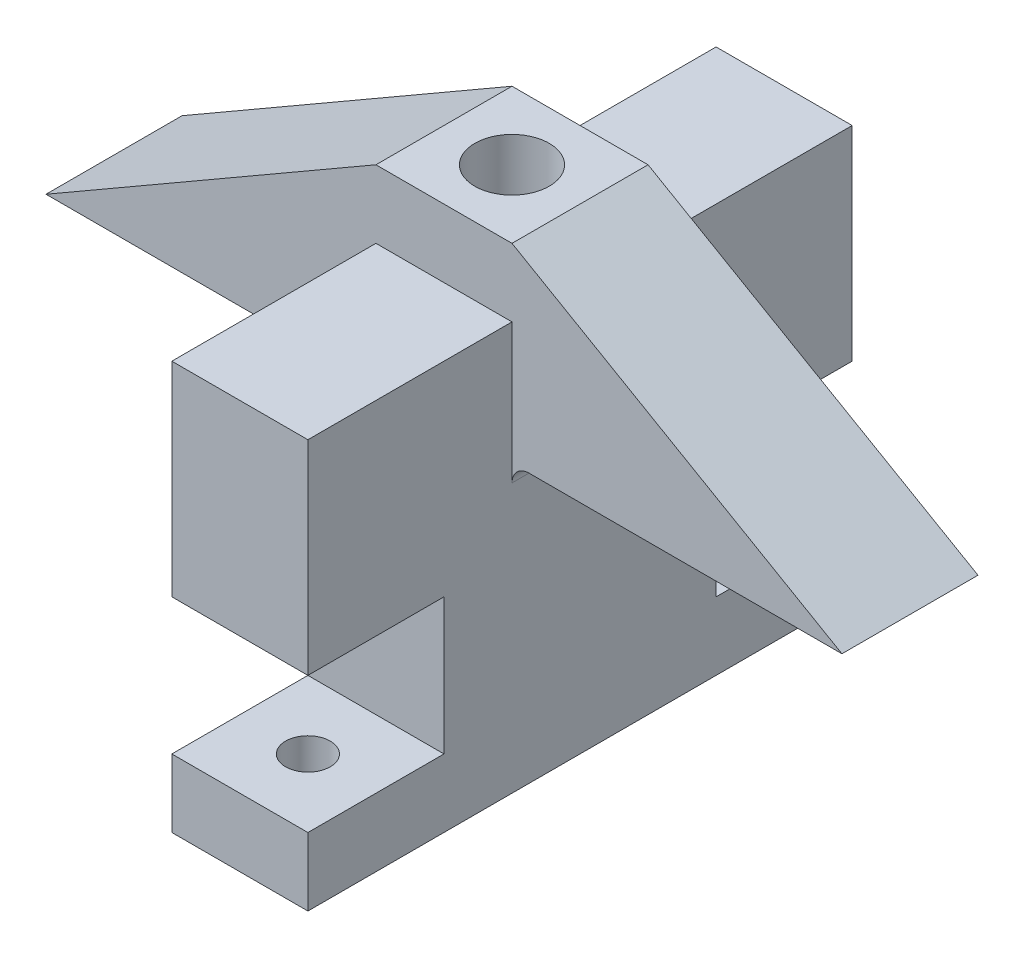
from build123d import *

# Parameters (mm, degrees)
BOSS_EXTRUDE1_DEPTH        = 25.4
SKETCH2_W                  = 25.4
SKETCH2_H                  = 12.7
BOSS_EXTRUDE2_DEPTH        = 38.1
SKETCH3_W                  = 25.4
SKETCH3_H                  = 12.7
BOSS_EXTRUDE3_DEPTH        = 38.1
F_0_328IN_DOWEL_HOLE1_D    = 8.3312
F_0_55IN_DOWEL_HOLE2_D     = 13.8938
F_0_55IN_DOWEL_HOLE2_DEPTH = 35.052
F_0_55IN_DOWEL_HOLE2_TIP   = 4.174118634
FILLET1_R                  = 3.175
SKETCH8_W                  = 25.4
SKETCH8_H                  = 25.4
BOSS_EXTRUDE4_DEPTH        = 12.7
BOSS_EXTRUDE5_DEPTH        = 38.1
SKETCH9_W                  = 25.4
SKETCH9_H                  = 25.4
BOSS_EXTRUDE6_DEPTH        = 12.7
BOSS_EXTRUDE7_DEPTH        = 38.1


with BuildPart() as part:
    # Sketch1 → Boss-Extrude1 (new body)
    with BuildSketch(Plane.XY):
        Polygon((0, 0), (0, 53.34), (-61.591726717, 53.34), (0, 88.9), (25.4, 88.9), (86.991726717, 53.34), (25.4, 53.34), (25.4, 0), align=None)
    extrude(amount=BOSS_EXTRUDE1_DEPTH)

    # Sketch2 → Boss-Extrude2 (add)
    with BuildSketch(Plane.XY.offset(25.4)):
        with Locations((12.7, 6.35)):
            Rectangle(SKETCH2_W, SKETCH2_H)
    extrude(amount=BOSS_EXTRUDE2_DEPTH)

    # Sketch3 → Boss-Extrude3 (add)
    with BuildSketch(Plane(origin=(0, 0, 0), x_dir=(-1, 0, 0), z_dir=(0, 0, -1))):
        with Locations((-12.7, 6.35)):
            Rectangle(SKETCH3_W, SKETCH3_H)
    extrude(amount=BOSS_EXTRUDE3_DEPTH)

    # Ø0.328in Dowel Hole1 (through all)
    with Locations(Plane(origin=(0, 12.7, 0), x_dir=(1, 0, 0), z_dir=(0, 1, 0))):
        with Locations((12.7, 25.4), (12.7, -50.8)):
            Hole(F_0_328IN_DOWEL_HOLE1_D / 2)

    # Ø0.55in Dowel Hole2
    with Locations(Plane(origin=(0, 88.9, 0), x_dir=(1, 0, 0), z_dir=(0, 1, 0))):
        with Locations((12.7, -12.7)):
            Hole(F_0_55IN_DOWEL_HOLE2_D / 2, depth=F_0_55IN_DOWEL_HOLE2_DEPTH)
            with Locations((0, 0, -(F_0_55IN_DOWEL_HOLE2_DEPTH + F_0_55IN_DOWEL_HOLE2_TIP / 2))):  # 118° drill point
                Cone(0, F_0_55IN_DOWEL_HOLE2_D / 2, F_0_55IN_DOWEL_HOLE2_TIP, mode=Mode.SUBTRACT)

    # Fillet1
    fillet1_edges = [part.edges().sort_by_distance(p)[0] for p in [
        (25.4, 53.34, 12.7),
        (0, 53.34, 12.7),
    ]]
    fillet(fillet1_edges, radius=FILLET1_R)

    # Sketch8 → Boss-Extrude4 (add)
    with BuildSketch(Plane.XY.offset(25.4)):
        with Locations((12.7, 25.4)):
            Rectangle(SKETCH8_W, SKETCH8_H)
    extrude(amount=BOSS_EXTRUDE4_DEPTH)

    # Sketch8<3> → Boss-Extrude5 (add)
    with BuildSketch(Plane.XY.offset(25.4)):
        Polygon((0, 50.165), (0, 38.1), (25.4, 38.1), (25.4, 76.2), (0, 76.2), align=None)
    extrude(amount=BOSS_EXTRUDE5_DEPTH)

    # Sketch9 → Boss-Extrude6 (add)
    with BuildSketch(Plane(origin=(0, 0, 0), x_dir=(-1, 0, 0), z_dir=(0, 0, -1))):
        with Locations((-12.7, 25.4)):
            Rectangle(SKETCH9_W, SKETCH9_H)
    extrude(amount=BOSS_EXTRUDE6_DEPTH)

    # Sketch9<3> → Boss-Extrude7 (add)
    with BuildSketch(Plane(origin=(0, 0, 0), x_dir=(-1, 0, 0), z_dir=(0, 0, -1))):
        Polygon((-25.4, 50.165), (-25.4, 38.1), (0, 38.1), (0, 50.165), (0, 76.2), (-25.4, 76.2), align=None)
    extrude(amount=BOSS_EXTRUDE7_DEPTH)


solid = part.part
